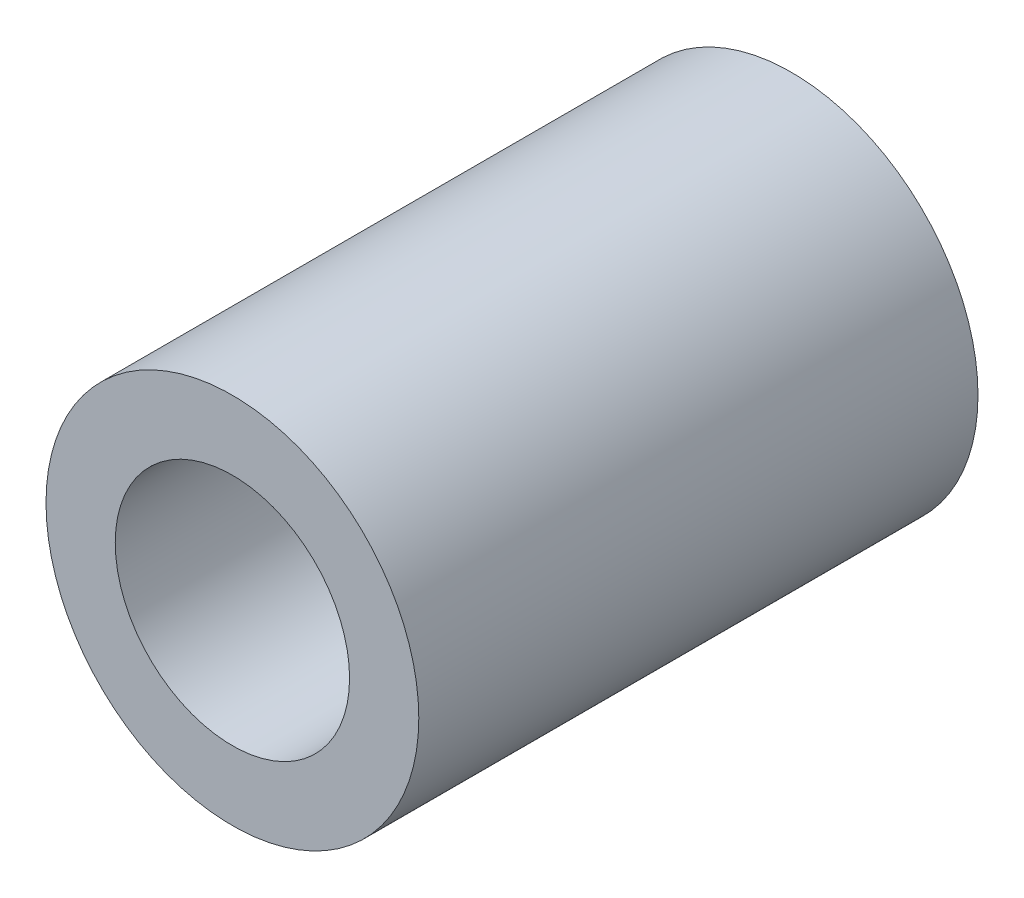
from build123d import *

# Parameters (mm, degrees)
SKETCH1_R           = 7
SKETCH1_R_2         = 4.4
BOSS_EXTRUDE1_DEPTH = 21


with BuildPart() as part:
    # Sketch1 → Boss-Extrude1 (new body)
    with BuildSketch(Plane.XY):
        with Locations(Location((0, 0, 0), (0, 0, 180))):
            Circle(SKETCH1_R)
        with Locations(Location((0, 0, 0), (0, 0, 180))):
            Circle(SKETCH1_R_2, mode=Mode.SUBTRACT)
    extrude(amount=BOSS_EXTRUDE1_DEPTH)


solid = part.part
